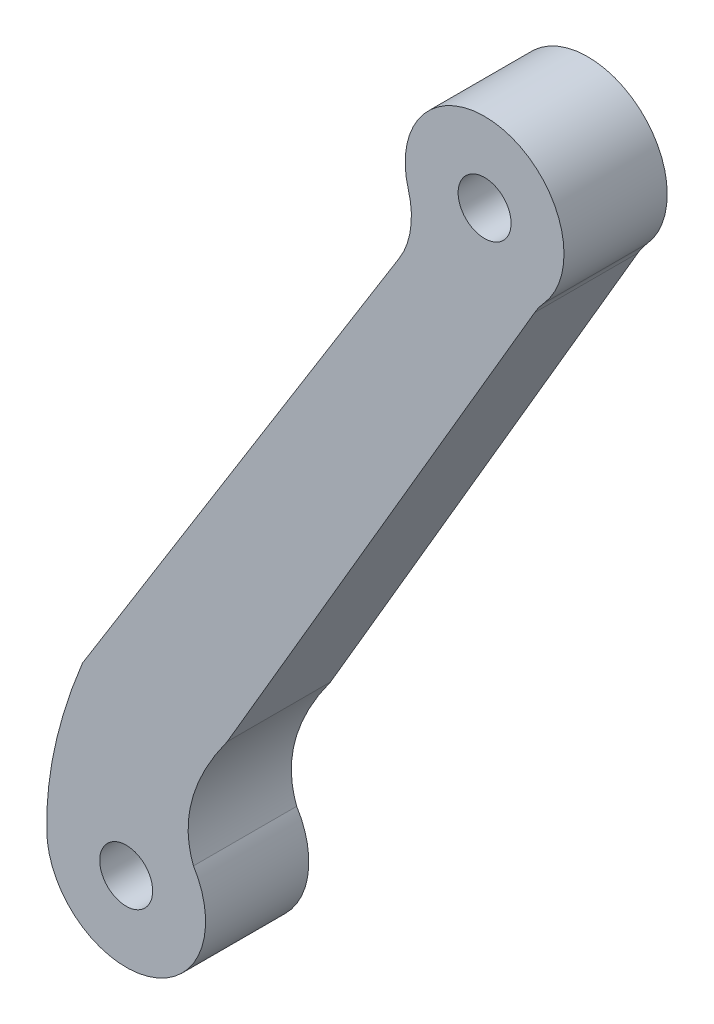
from build123d import *

# Parameters (mm, degrees)
SKETCH6_R           = 1
BOSS_EXTRUDE1_DEPTH = 3.9


with BuildPart() as part:
    # Sketch6 → Boss-Extrude1 (new body)
    with BuildSketch(Plane.XY):
        with BuildLine():
            Line((24.518959729, 113.266913748), (12.546015233, 94.029173129))
            add(Edge.make_bspline(
                [(12.546015233, 94.029173129), (11.143200975, 90.620780812), (11.195857544, 87.895488842)],
                knots=[0, 0, 0, 1, 1, 1], degree=2))
            ThreePointArc((11.195857544, 87.895488842), (15.023721592, 85.0119769), (16.738951622, 89.486926087))
            add(Edge.make_bspline(
                [(18.016460853, 94.194825281), (15.988617018, 91.415760023), (16.738951622, 89.486926087)],
                knots=[0, 0, 0, 1, 1, 1], degree=2))
            Line((18.016460853, 94.194825281), (29.628743828, 114.037411274))
            ThreePointArc((29.628743828, 114.037411274), (29.791338928, 114.286113373), (29.977739072, 114.517511055))
            ThreePointArc((29.977739072, 114.517511055), (28.402741778, 119.438186194), (24.854741229, 115.682476887))
            ThreePointArc((24.854741229, 115.682476887), (24.943384664, 114.439035131), (24.518959729, 113.266913748))
        make_face()
        with Locations((27.737526551, 116.51286763)):
            Circle(SKETCH6_R, mode=Mode.SUBTRACT)
        with Locations((14.195857544, 87.895488842)):
            Circle(SKETCH6_R, mode=Mode.SUBTRACT)
    extrude(amount=BOSS_EXTRUDE1_DEPTH)


solid = part.part
